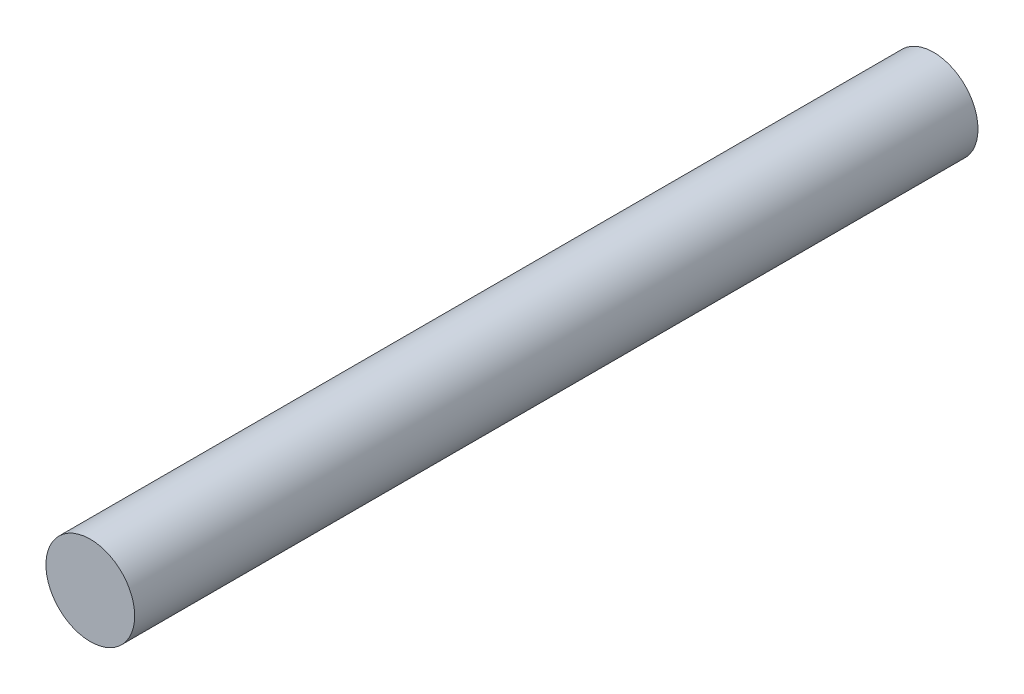
from build123d import *

# Parameters (mm, degrees)
SKETCH1_R           = 4
BOSS_EXTRUDE1_DEPTH = 76


with BuildPart() as part:
    # Sketch1 → Boss-Extrude1 (new body)
    with BuildSketch(Plane.XY):
        Circle(SKETCH1_R)
    extrude(amount=BOSS_EXTRUDE1_DEPTH)


solid = part.part
